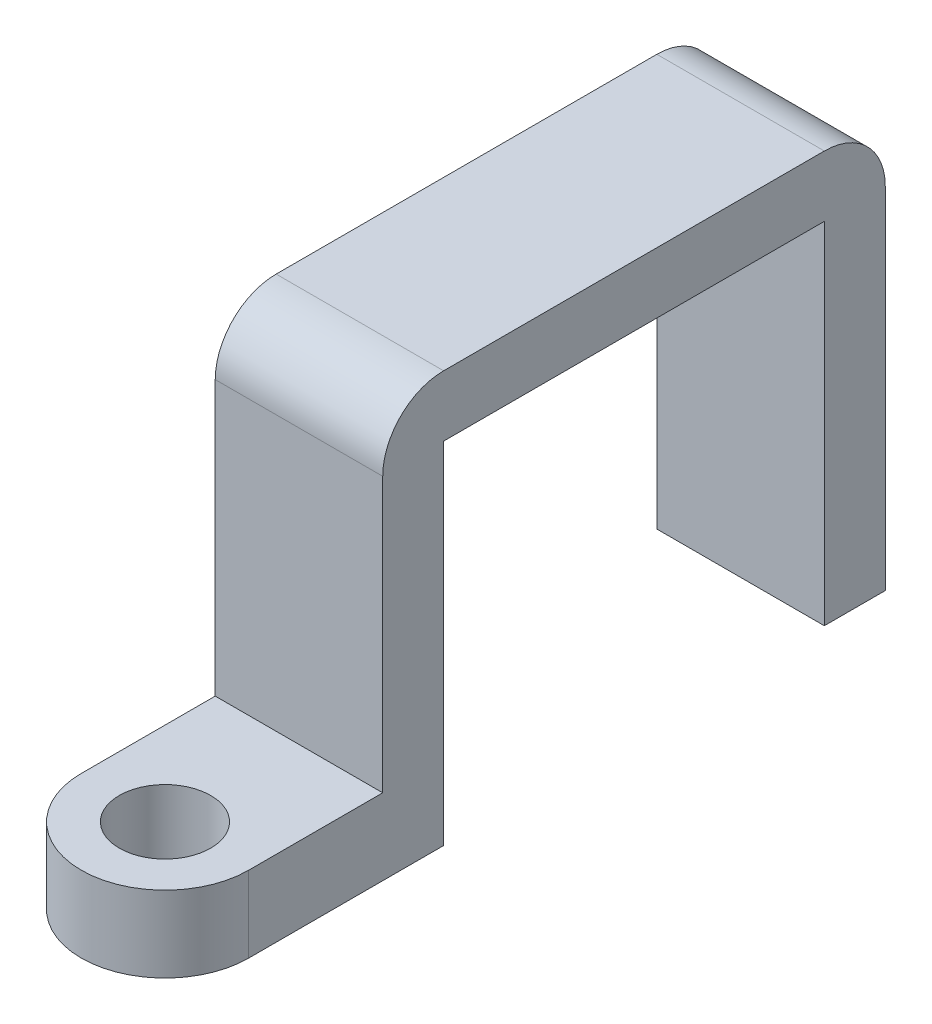
from build123d import *

# Parameters (mm, degrees)
SKETCH2_R           = 1.5
BOSS_EXTRUDE1_DEPTH = 2.5
SKETCH3_W           = 5.5
SKETCH3_H           = 2
BOSS_EXTRUDE2_DEPTH = 9
SKETCH4_W           = 5.5
SKETCH4_H           = 16.5
BOSS_EXTRUDE3_DEPTH = 2
SKETCH5_W           = 5.5
SKETCH5_H           = 2
BOSS_EXTRUDE4_DEPTH = 11.5
FILLET1_R           = 2


with BuildPart() as part:
    # Sketch2 → Boss-Extrude1 (new body)
    with BuildSketch(Plane(origin=(0, 0, 0), x_dir=(1, 0, 0), z_dir=(0, 1, 0))):
        with BuildLine():
            Line((-2.75, 0), (-2.75, 6.4))
            Line((-2.75, 6.4), (2.75, 6.4))
            Line((2.75, 6.4), (2.75, 0))
            ThreePointArc((2.75, 0), (0, -2.75), (-2.75, 0))
        make_face()
        with Locations(Location((0, 0, 0), (0, 0, 270))):
            Circle(SKETCH2_R, mode=Mode.SUBTRACT)
    extrude(amount=BOSS_EXTRUDE1_DEPTH)

    # Sketch3 → Boss-Extrude2 (add)
    with BuildSketch(Plane(origin=(0, 2.5, 0), x_dir=(1, 0, 0), z_dir=(0, 1, 0))):
        with Locations((0, 5.4)):
            Rectangle(SKETCH3_W, SKETCH3_H)
    extrude(amount=BOSS_EXTRUDE2_DEPTH)

    # Sketch4 → Boss-Extrude3 (add)
    with BuildSketch(Plane(origin=(0, 11.5, 0), x_dir=(1, 0, 0), z_dir=(0, 1, 0))):
        with Locations((0, 12.65)):
            Rectangle(SKETCH4_W, SKETCH4_H)
    extrude(amount=BOSS_EXTRUDE3_DEPTH)

    # Sketch5 → Boss-Extrude4 (add)
    with BuildSketch(Plane.XZ.offset(-11.5)):
        with Locations((0, -19.9)):
            Rectangle(SKETCH5_W, SKETCH5_H)
    extrude(amount=BOSS_EXTRUDE4_DEPTH)

    # Fillet1
    fillet1_edges = [part.edges().sort_by_distance(p)[0] for p in [
        (0, 13.5, -4.4),
        (0, 13.5, -20.9),
    ]]
    fillet(fillet1_edges, radius=FILLET1_R)


solid = part.part
